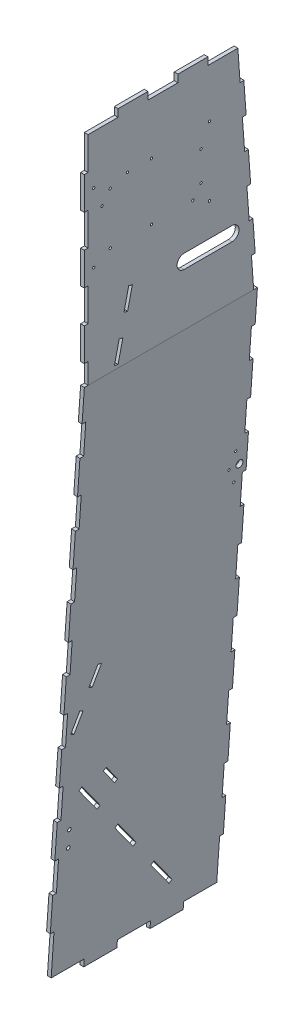
from build123d import *

# Parameters (mm, degrees)
BOSS_EXTRUDE1_DEPTH = 469.9
SKETCH2_W           = 10.16
SKETCH2_H           = 83.651125112
SKETCH2_H_2         = 83.677721465
SKETCH2_H_3         = 83.704317819
SKETCH2_H_4         = 83.730914172
SKETCH2_H_5         = 83.757510526
SKETCH2_H_6         = 83.784106879
SKETCH2_H_7         = 83.810703233
SKETCH2_H_8         = 133.264269193
CUT_EXTRUDE1_DEPTH  = 10.16
SKETCH3_W           = 10.16
SKETCH3_H           = 55.879999965
SKETCH3_H_2         = 88.9
SKETCH3_H_3         = 109.22
CUT_EXTRUDE2_DEPTH  = 12.7
SKETCH4_W           = 81.316938584
SKETCH4_H           = 20.32
SKETCH4_W_2         = 81.316938585
CUT_EXTRUDE3_DEPTH  = 12.7
SKETCH5_W           = 89.916
SKETCH5_H           = 20.32
CUT_EXTRUDE4_DEPTH  = 12.7
CUT_EXTRUDE5_DEPTH  = 137.414
SKETCH8_R           = 9.525
CUT_EXTRUDE7_DEPTH  = 2128.667464702
SKETCH13_R          = 3.175
CUT_EXTRUDE8_DEPTH  = 2128.667464702
CUT_EXTRUDE9_DEPTH  = 2128.667464702
SKETCH20_R          = 4.7625
CUT_EXTRUDE10_DEPTH = 2107.728843747
SKETCH23_R          = 3.175
CUT_EXTRUDE11_DEPTH = 2107.728843747


with BuildPart() as part:
    # Sketch1 → Boss-Extrude1 (new body)
    with BuildSketch(Plane.XY):
        Polygon((-215.881789204, 2052.32), (-215.881789204, 1463.040000035), (-316.088635901, 20.32), (-317.499999939, 0), (-307.333509538, 0), (-205.715298803, 1463.040000035), (-205.715298803, 2072.64), (-215.881789204, 2072.64), align=None)
    extrude(amount=-BOSS_EXTRUDE1_DEPTH)

    # Sketch2 → Cut-Extrude1 (cut)
    with BuildSketch(Plane(origin=(-315.975651309, 21.946686571, 0), x_dir=(0, 0, 1), z_dir=(-0.9975965627192115, 0.06928995634877068, 0))):
        with Locations((-464.82, 1313.852971026)):
            Rectangle(SKETCH2_W, SKETCH2_H)
        with Locations((-464.82, 1136.066269203)):
            Rectangle(SKETCH2_W, SKETCH2_H_2)
        with Locations((-464.82, 958.27956738)):
            Rectangle(SKETCH2_W, SKETCH2_H_3)
        with Locations((-464.82, 780.492865556)):
            Rectangle(SKETCH2_W, SKETCH2_H_4)
        with Locations((-464.82, 602.706163733)):
            Rectangle(SKETCH2_W, SKETCH2_H_5)
        with Locations((-464.82, 424.91946191)):
            Rectangle(SKETCH2_W, SKETCH2_H_6)
        with Locations((-464.82, 247.132760087)):
            Rectangle(SKETCH2_W, SKETCH2_H_7)
        with Locations((-464.82, 44.63257346)):
            Rectangle(SKETCH2_W, SKETCH2_H_8)
        with Locations((-5.08, 44.63257346)):
            Rectangle(SKETCH2_W, SKETCH2_H_8)
        with Locations((-5.08, 247.132760087)):
            Rectangle(SKETCH2_W, SKETCH2_H_7)
        with Locations((-5.08, 424.91946191)):
            Rectangle(SKETCH2_W, SKETCH2_H_6)
        with Locations((-5.08, 602.706163733)):
            Rectangle(SKETCH2_W, SKETCH2_H_5)
        with Locations((-5.08, 780.492865556)):
            Rectangle(SKETCH2_W, SKETCH2_H_4)
        with Locations((-5.08, 958.27956738)):
            Rectangle(SKETCH2_W, SKETCH2_H_3)
        with Locations((-5.08, 1136.066269203)):
            Rectangle(SKETCH2_W, SKETCH2_H_2)
        with Locations((-5.08, 1313.852971026)):
            Rectangle(SKETCH2_W, SKETCH2_H)
    extrude(amount=-CUT_EXTRUDE1_DEPTH, mode=Mode.SUBTRACT)

    # Sketch3 → Cut-Extrude2 (cut)
    with BuildSketch(Plane.ZY.offset(215.881789204)):
        with Locations((-5.08, 1490.980000018)):
            Rectangle(SKETCH3_W, SKETCH3_H)
        with Locations((-5.08, 1652.27)):
            Rectangle(SKETCH3_W, SKETCH3_H_2)
        Polygon((-469.9, 1463.040000035), (-459.713026258, 1463.040000035), (-453.620872406, 1546.589538567), (-463.753970086, 1547.328410273), (-457.607940173, 1631.616820512), (-447.474842492, 1630.877948806), (-441.328812579, 1715.166359045), (-451.461910259, 1715.905230751), (-445.315880346, 1800.19364099), (-435.182782665, 1799.454769284), (-429.036752752, 1883.743179522), (-439.169850432, 1884.482051228), (-433.023820518, 1968.770461467), (-422.890722838, 1968.031589761), (-415.263026258, 2072.64), (-469.9, 2072.64), align=None)
        with Locations((-5.08, 1830.07)):
            Rectangle(SKETCH3_W, SKETCH3_H_2)
        with Locations((-5.08, 2018.03)):
            Rectangle(SKETCH3_W, SKETCH3_H_3)
    extrude(amount=-CUT_EXTRUDE2_DEPTH, mode=Mode.SUBTRACT)

    # Sketch4 → Cut-Extrude3 (cut)
    with BuildSketch(Plane.ZY.offset(215.881789204)):
        with Locations((-376.086223632, 2062.48)):
            Rectangle(SKETCH4_W, SKETCH4_H)
        with Locations((-213.452346463, 2062.48)):
            Rectangle(SKETCH4_W_2, SKETCH4_H)
        with Locations((-50.818469292, 2062.48)):
            Rectangle(SKETCH4_W_2, SKETCH4_H)
    extrude(amount=-CUT_EXTRUDE3_DEPTH, mode=Mode.SUBTRACT)

    # Sketch5 → Cut-Extrude4 (cut)
    with BuildSketch(Plane(origin=(-315.975651309, 21.946686571, 0), x_dir=(0, 0, 1), z_dir=(-0.9975965627192115, 0.06928995634877068, 0))):
        with Locations((-414.782, -11.839561137)):
            Rectangle(SKETCH5_W, SKETCH5_H)
        with Locations((-234.95, -11.839561137)):
            Rectangle(SKETCH5_W, SKETCH5_H)
        with Locations((-55.118, -11.839561137)):
            Rectangle(SKETCH5_W, SKETCH5_H)
    extrude(amount=-CUT_EXTRUDE4_DEPTH, mode=Mode.SUBTRACT)

    # Sketch6 → Cut-Extrude5 (cut)
    with BuildSketch(Plane(origin=(-315.975651309, 21.946686571, 0), x_dir=(0, 0, 1), z_dir=(-0.9975965627192115, 0.06928995634877068, 0))):
        Polygon((-225.552848619, 218.022150673), (-217.372552167, 211.996509631), (-163.440168374, 285.214095065), (-171.620464825, 291.239736107), align=None)
        Polygon((-333.417616206, 71.586979805), (-325.230382227, 65.556228551), (-271.297998434, 138.773813985), (-279.485232413, 144.804565239), align=None)
        Polygon((-117.688081031, 364.457321541), (-109.500847052, 358.426570287), (-55.568463259, 431.644155721), (-63.755697238, 437.674906975), align=None)
        Polygon((-22.52887933, 586.435803877), (-44.10850301, 632.676529752), (-53.31924736, 628.378059234), (-31.73962368, 582.137333359), align=None)
        Polygon((-96.478494721, 720.859510985), (-74.89887104, 674.61878511), (-65.68812669, 678.917255627), (-87.26775037, 725.157981502), align=None)
    extrude(amount=-CUT_EXTRUDE5_DEPTH, mode=Mode.SUBTRACT)

    # Sketch8 → Cut-Extrude7 (cut, through all)
    with BuildSketch(Plane.ZY.offset(215.881789204)):
        with Locations((-450.215, 1043.94)):
            Circle(SKETCH8_R)
    extrude(amount=CUT_EXTRUDE7_DEPTH, mode=Mode.SUBTRACT)

    # Sketch13 → Cut-Extrude8 (cut, through all)
    with BuildSketch(Plane.ZY.offset(215.881789204)):
        with BuildLine():
            Line((-400.855976046, 1605.059439633), (-270.871476046, 1605.059439633))
            ThreePointArc((-270.871476046, 1605.059439633), (-251.821476046, 1624.109439633), (-270.871476046, 1643.159439633))
            Line((-270.871476046, 1643.159439633), (-400.855976046, 1643.159439633))
            ThreePointArc((-400.855976046, 1643.159439633), (-419.905976046, 1624.109439633), (-400.855976046, 1605.059439633))
        make_face()
        with Locations((-25.246459893, 1731.87)):
            Circle(SKETCH13_R)
        with Locations((-70.408959893, 1755.42)):
            Circle(SKETCH13_R)
        with Locations((-182.408959893, 1755.42)):
            Circle(SKETCH13_R)
        with Locations((-25.246459893, 1918.97)):
            Circle(SKETCH13_R)
        with Locations((-47.788959893, 1865.42)):
            Circle(SKETCH13_R)
        with Locations((-182.408959893, 1910.42)):
            Circle(SKETCH13_R)
        with Locations((-117.078959893, 1910.42)):
            Circle(SKETCH13_R)
        with Locations((-70.408959893, 1895.42)):
            Circle(SKETCH13_R)
        with Locations((-317.028959893, 1865.42)):
            Circle(SKETCH13_R)
        with Locations((-294.408959893, 1755.42)):
            Circle(SKETCH13_R)
        with Locations((-317.028959893, 1785.42)):
            Circle(SKETCH13_R)
        with Locations((-339.571459893, 1731.87)):
            Circle(SKETCH13_R)
        with Locations((-339.571459893, 1918.97)):
            Circle(SKETCH13_R)
    extrude(amount=-CUT_EXTRUDE8_DEPTH, mode=Mode.SUBTRACT)

    # Sketch17 → Cut-Extrude9 (cut, through all)
    with BuildSketch(Plane.ZY.offset(215.881789204)):
        Polygon((-120.524654614, 1641.945974367), (-130.424254473, 1639.660471655), (-117.483615058, 1583.608404231), (-107.584015199, 1585.893906943), align=None)
        Polygon((-94.643375784, 1529.841839519), (-104.542975642, 1527.556336807), (-91.602336227, 1471.504269383), (-81.702736369, 1473.789772095), align=None)
    extrude(amount=-CUT_EXTRUDE9_DEPTH, mode=Mode.SUBTRACT)

    # Sketch20 → Cut-Extrude10 (cut, through all)
    with BuildSketch(Plane(origin=(-315.975651309, 21.946686571, 0), x_dir=(0, 0, 1), z_dir=(-0.9975965627192116, 0.06928995634876853, 0))):
        Polygon((-128.598334701, 451.361418049), (-162.492565561, 405.347250509), (-154.823537638, 399.698212032), (-120.929306778, 445.712379572), align=None)
        with Locations((-35.56, 347.287639338)):
            Circle(SKETCH20_R)
        with Locations((-35.56, 302.837639338)):
            Circle(SKETCH20_R)
    extrude(amount=-CUT_EXTRUDE10_DEPTH, mode=Mode.SUBTRACT)

    # Sketch23 → Cut-Extrude11 (cut, through all)
    with BuildSketch(Plane(origin=(-315.975651309, 21.946686571, 0), x_dir=(0, 0, 1), z_dir=(-0.9975965627192116, 0.06928995634876853, 0))):
        with Locations((-437.515, 986.355528037)):
            Circle(SKETCH23_R)
        with Locations((-421.64, 1024.455528037)):
            Circle(SKETCH23_R)
        with Locations((-437.515, 1062.555528037)):
            Circle(SKETCH23_R)
    extrude(amount=-CUT_EXTRUDE11_DEPTH, mode=Mode.SUBTRACT)


solid = part.part
